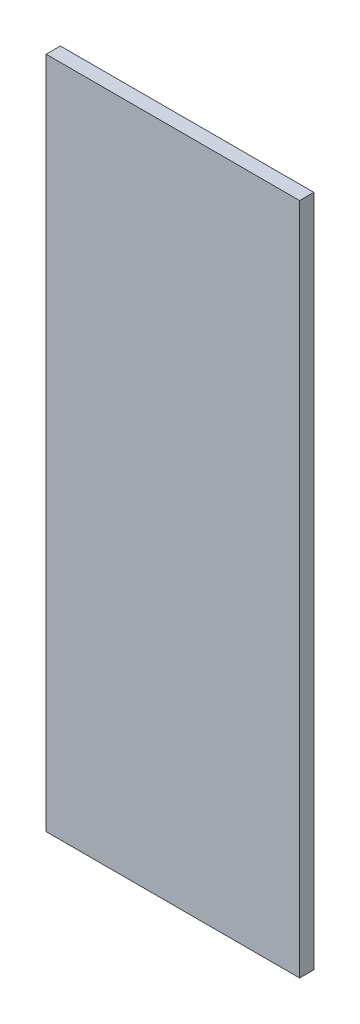
from build123d import *

# Parameters (mm, degrees)
SKETCH2_W           = 56.55
SKETCH2_H           = 150.2
BOSS_EXTRUDE1_DEPTH = 3.175


with BuildPart() as part:
    # Sketch2 → Boss-Extrude1 (new body)
    with BuildSketch(Plane.XY):
        Rectangle(SKETCH2_W, SKETCH2_H)
    extrude(amount=BOSS_EXTRUDE1_DEPTH)


solid = part.part
